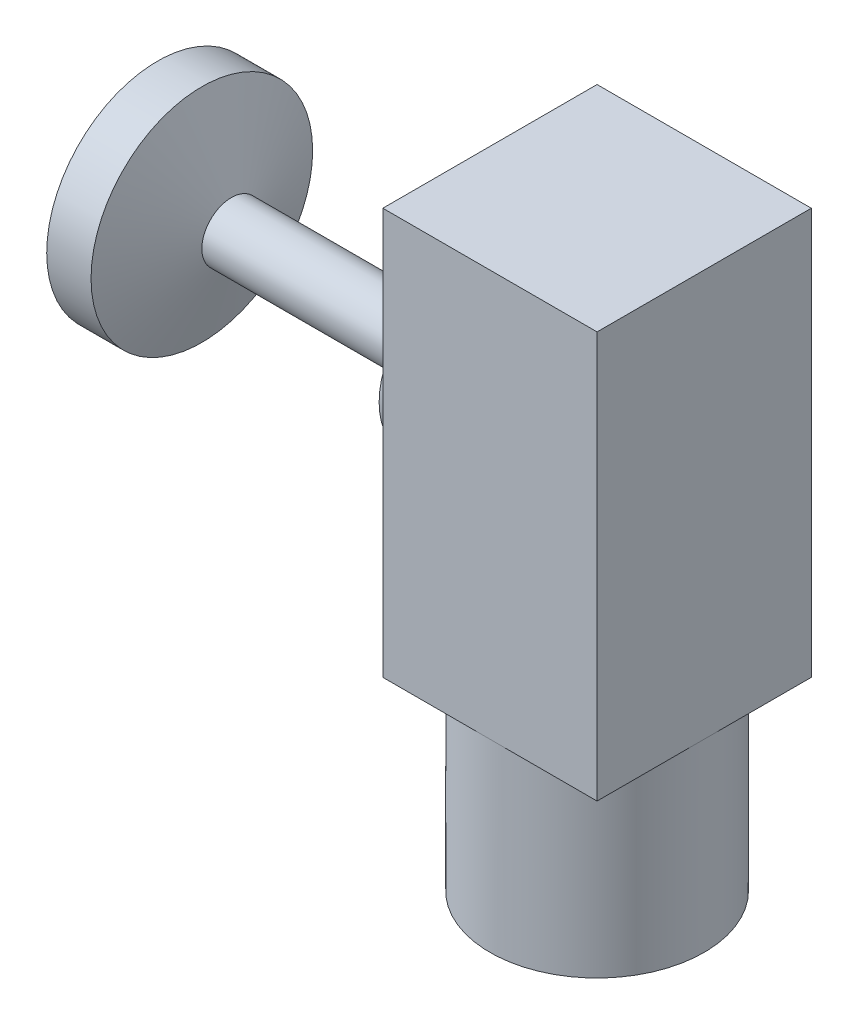
from build123d import *

# Parameters (mm, degrees)
SKETCH_2_W      = 29
SKETCH_2_H      = 55
EXTRUDE_1_DEPTH = 29
SKETCH_3_R      = 14.5
EXTRUDE_2_DEPTH = 25


with BuildPart() as part:
    # 草图1 → 旋转3 (revolve)
    with BuildSketch(Plane.XY, mode=Mode.PRIVATE) as revolve_3_sk:
        Polygon((-10, 15), (-10, 0), (35, 0), (35, 10), (30, 10), (30, 4), (0, 4), (-4, 15), align=None)
    revolve(revolve_3_sk.sketch.rotate(Axis((-10, 0, 0), (1, 0, 0)), 90), axis=Axis((-10, 0, 0), (1, 0, 0)))

    # 草图2 → 凸台-拉伸1 (add)
    with BuildSketch(Plane(origin=(35, 0, 0), x_dir=(0, 0, -1), z_dir=(1, 0, 0))):
        Rectangle(SKETCH_2_W, SKETCH_2_H)
    extrude(amount=EXTRUDE_1_DEPTH)

    # 草图3 → 凸台-拉伸2 (add)
    with BuildSketch(Plane.XZ.offset(27.5)):
        with Locations(Location((49.5, 0, 0), (0, 0, 270))):
            Circle(SKETCH_3_R)
    extrude(amount=EXTRUDE_2_DEPTH)


solid = part.part
